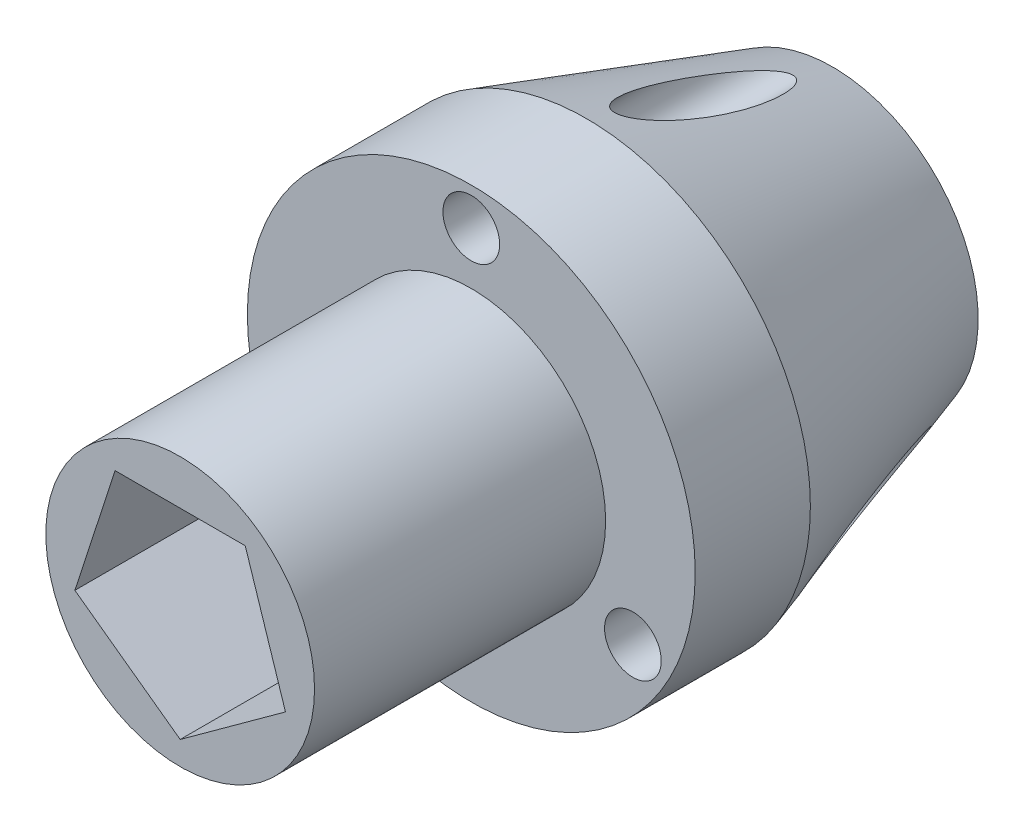
from build123d import *

# Parameters (mm, degrees)
SKETCH2_R                      = 9
BOSS_EXTRUDE1_DEPTH            = 19.5
CUT_EXTRUDE1_DEPTH             = 49.576640477
F_3_8_3_8_DIAMETER_HOLE1_D     = 3.8
F_3_8_3_8_DIAMETER_HOLE1_DEPTH = 24.2


with BuildPart() as part:
    # Sketch1 → Revolve1 (revolve)
    with BuildSketch(Plane.XZ, mode=Mode.PRIVATE) as revolve1_sk:
        Polygon((15, 24.2), (0, 24.2), (0, 0), (9.754545455, 0), (15, 16.485714286), align=None)
    revolve(revolve1_sk.sketch.rotate(Axis((0, 0, 24.2), (0, 0, -1)), 180), axis=Axis((0, 0, 24.2), (0, 0, -1)))

    # Sketch2 → Boss-Extrude1 (add)
    with BuildSketch(Plane.XY.offset(24.2)):
        Circle(SKETCH2_R)
    extrude(amount=BOSS_EXTRUDE1_DEPTH)

    # Sketch3 → Cut-Extrude1 (cut, through all)
    with BuildSketch(Plane(origin=(0, 0, 0), x_dir=(-1, 0, 0), z_dir=(0, 0, -1))):
        Polygon((0, -7.416407865), (7.053423028, -2.291796068), (4.359255168, 6), (-4.359255168, 6), (-7.053423028, -2.291796068), align=None)
    extrude(amount=-CUT_EXTRUDE1_DEPTH, mode=Mode.SUBTRACT)

    # Ø3.8 (3.8) Diameter Hole1
    with Locations(Plane.XY.offset(24.2)):
        with Locations((10.825317547, -6.25), (-10.825317547, -6.25), (0, 12.5)):
            Hole(F_3_8_3_8_DIAMETER_HOLE1_D / 2, depth=F_3_8_3_8_DIAMETER_HOLE1_DEPTH)


solid = part.part
